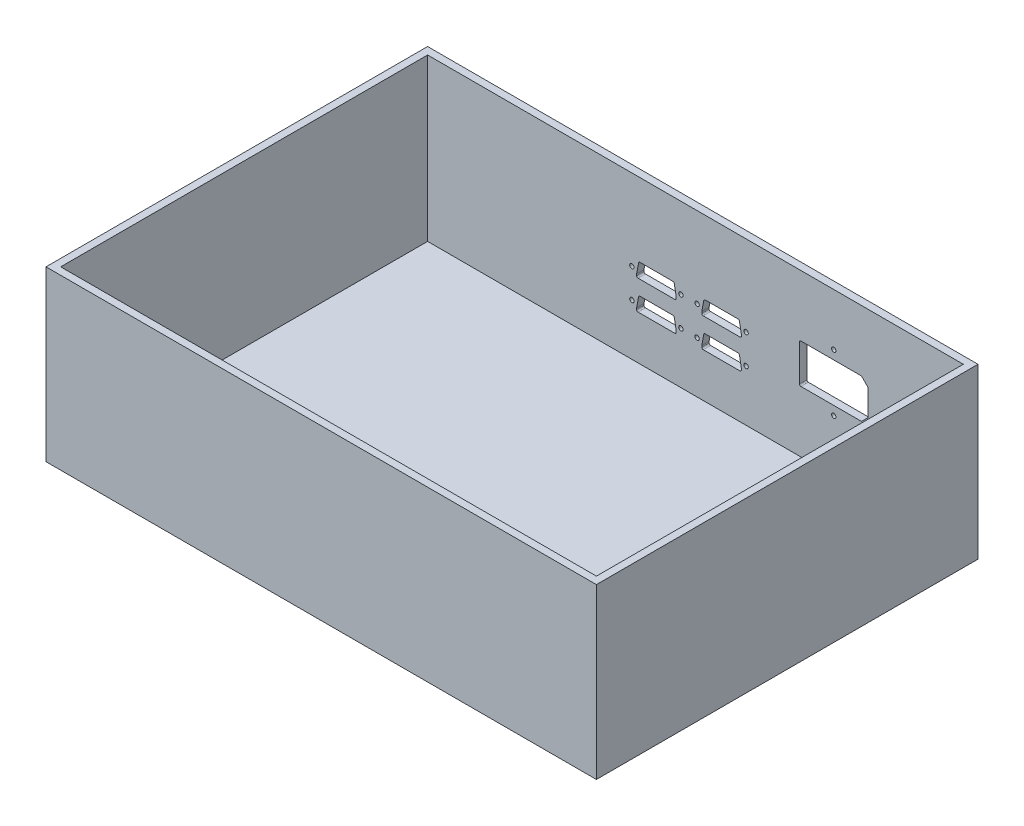
from build123d import *

# Parameters (mm, degrees)
SKETCH_1_W          = 375
SKETCH_1_H          = 260
EXTRUDE_1_DEPTH     = 115
SHELL_1_T           = -5
SKETCH_2_R          = 1.5
CUT_EXTRUDE_1_DEPTH = 5


with BuildPart() as part:
    # Эскиз1 → Бобышка-Вытянуть1 (new body)
    with BuildSketch(Plane(origin=(0, 0, 0), x_dir=(1, 0, 0), z_dir=(0, 1, 0))):
        Rectangle(SKETCH_1_W, SKETCH_1_H)
    extrude(amount=EXTRUDE_1_DEPTH)

    # Оболочка1
    shell_1_openings = [part.faces().sort_by_distance(p)[0] for p in [
        (0, 115, 0),
    ]]
    offset(amount=SHELL_1_T, openings=shell_1_openings, kind=Kind.INTERSECTION)

    # Эскиз2 → Вырез-Вытянуть1 (cut)
    with BuildSketch(Plane(origin=(0, 0, -130), x_dir=(-1, 0, 0), z_dir=(0, 0, -1))):
        with Locations((-34.5, 60)):
            Circle(SKETCH_2_R)
        with Locations(Location((-1.1, 60, 0), (0, 0, 180))):
            Circle(SKETCH_2_R)
        with Locations((9.9, 60)):
            Circle(SKETCH_2_R)
        with Locations(Location((43.3, 60, 0), (0, 0, 180))):
            Circle(SKETCH_2_R)
        with Locations((-34.5, 40)):
            Circle(SKETCH_2_R)
        with Locations(Location((-1.1, 40, 0), (0, 0, 180))):
            Circle(SKETCH_2_R)
        with Locations((9.9, 40)):
            Circle(SKETCH_2_R)
        with Locations(Location((43.3, 40, 0), (0, 0, 180))):
            Circle(SKETCH_2_R)
        with Locations((-94.2, 40.5)):
            Circle(SKETCH_2_R)
        with Locations((-94.2, 79.5)):
            Circle(SKETCH_2_R)
        with BuildLine():
            Line((-31.3, 57), (-29.9529459, 64.184288535))
            ThreePointArc((-29.9529459, 64.184288535), (-29.60870955, 64.769509108), (-28.970073713, 65))
            Line((-28.970073713, 65), (-6.629926287, 65))
            ThreePointArc((-6.629926287, 65), (-5.99129045, 64.769509108), (-5.6470541, 64.184288535))
            Line((-5.6470541, 64.184288535), (-4.317127813, 57.091348336))
            ThreePointArc((-4.317127813, 57.091348336), (-4.30429116, 56.999601179), (-4.3, 56.907059801))
            Line((-4.3, 56.907059801), (-4.3, 56))
            ThreePointArc((-4.3, 56), (-4.592893219, 55.292893219), (-5.3, 55))
            Line((-5.3, 55), (-30.3, 55))
            ThreePointArc((-30.3, 55), (-31.007106781, 55.292893219), (-31.3, 56))
            Line((-31.3, 56), (-31.3, 57))
        make_face()
        with BuildLine():
            Line((13.1, 57), (14.4470541, 64.184288535))
            ThreePointArc((14.4470541, 64.184288535), (14.79129045, 64.769509108), (15.429926287, 65))
            Line((15.429926287, 65), (37.770073713, 65))
            ThreePointArc((37.770073713, 65), (38.40870955, 64.769509108), (38.7529459, 64.184288535))
            Line((38.7529459, 64.184288535), (40.082872187, 57.091348336))
            ThreePointArc((40.082872187, 57.091348336), (40.09570884, 56.999601179), (40.1, 56.907059801))
            Line((40.1, 56.907059801), (40.1, 56))
            ThreePointArc((40.1, 56), (39.807106781, 55.292893219), (39.1, 55))
            Line((39.1, 55), (14.1, 55))
            ThreePointArc((14.1, 55), (13.392893219, 55.292893219), (13.1, 56))
            Line((13.1, 56), (13.1, 57))
        make_face()
        with BuildLine():
            Line((-31.3, 37), (-29.9529459, 44.184288535))
            ThreePointArc((-29.9529459, 44.184288535), (-29.60870955, 44.769509108), (-28.970073713, 45))
            Line((-28.970073713, 45), (-6.629926287, 45))
            ThreePointArc((-6.629926287, 45), (-5.99129045, 44.769509108), (-5.6470541, 44.184288535))
            Line((-5.6470541, 44.184288535), (-4.317127813, 37.091348336))
            ThreePointArc((-4.317127813, 37.091348336), (-4.30429116, 36.999601179), (-4.3, 36.907059801))
            Line((-4.3, 36.907059801), (-4.3, 36))
            ThreePointArc((-4.3, 36), (-4.592893219, 35.292893219), (-5.3, 35))
            Line((-5.3, 35), (-30.3, 35))
            ThreePointArc((-30.3, 35), (-31.007106781, 35.292893219), (-31.3, 36))
            Line((-31.3, 36), (-31.3, 37))
        make_face()
        with BuildLine():
            Line((13.1, 37), (14.4470541, 44.184288535))
            ThreePointArc((14.4470541, 44.184288535), (14.79129045, 44.769509108), (15.429926287, 45))
            Line((15.429926287, 45), (37.770073713, 45))
            ThreePointArc((37.770073713, 45), (38.40870955, 44.769509108), (38.7529459, 44.184288535))
            Line((38.7529459, 44.184288535), (40.082872187, 37.091348336))
            ThreePointArc((40.082872187, 37.091348336), (40.09570884, 36.999601179), (40.1, 36.907059801))
            Line((40.1, 36.907059801), (40.1, 36))
            ThreePointArc((40.1, 36), (39.807106781, 35.292893219), (39.1, 35))
            Line((39.1, 35), (14.1, 35))
            ThreePointArc((14.1, 35), (13.392893219, 35.292893219), (13.1, 36))
            Line((13.1, 36), (13.1, 37))
        make_face()
        with BuildLine():
            Line((-113.1, 46.6), (-71.9, 46.6))
            ThreePointArc((-71.9, 46.6), (-71.192893219, 46.892893219), (-70.9, 47.6))
            Line((-70.9, 47.6), (-70.9, 72.4))
            ThreePointArc((-70.9, 72.4), (-71.192893219, 73.107106781), (-71.9, 73.4))
            Line((-71.9, 73.4), (-113.1, 73.4))
            Line((-113.1, 73.4), (-117.5, 69))
            Line((-117.5, 69), (-117.5, 51))
            Line((-117.5, 51), (-113.1, 46.6))
        make_face()
    extrude(amount=-CUT_EXTRUDE_1_DEPTH, mode=Mode.SUBTRACT)


solid = part.part
